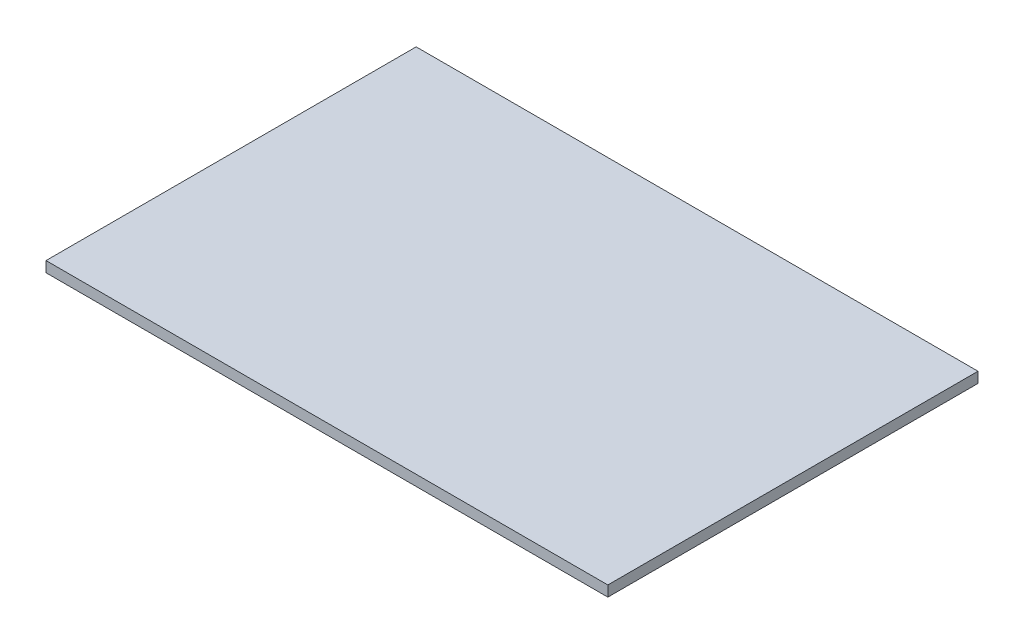
from build123d import *

# Parameters (mm, degrees)
SKETCH1_W        = 85
SKETCH1_H        = 56
PRINTPLAAT_DEPTH = 1.6


with BuildPart() as part:
    # Sketch1 → Printplaat (new body)
    with BuildSketch(Plane(origin=(0, 0, 0), x_dir=(1, 0, 0), z_dir=(0, 1, 0))):
        with Locations((42.5, 28)):
            Rectangle(SKETCH1_W, SKETCH1_H)
    extrude(amount=PRINTPLAAT_DEPTH)


solid = part.part
